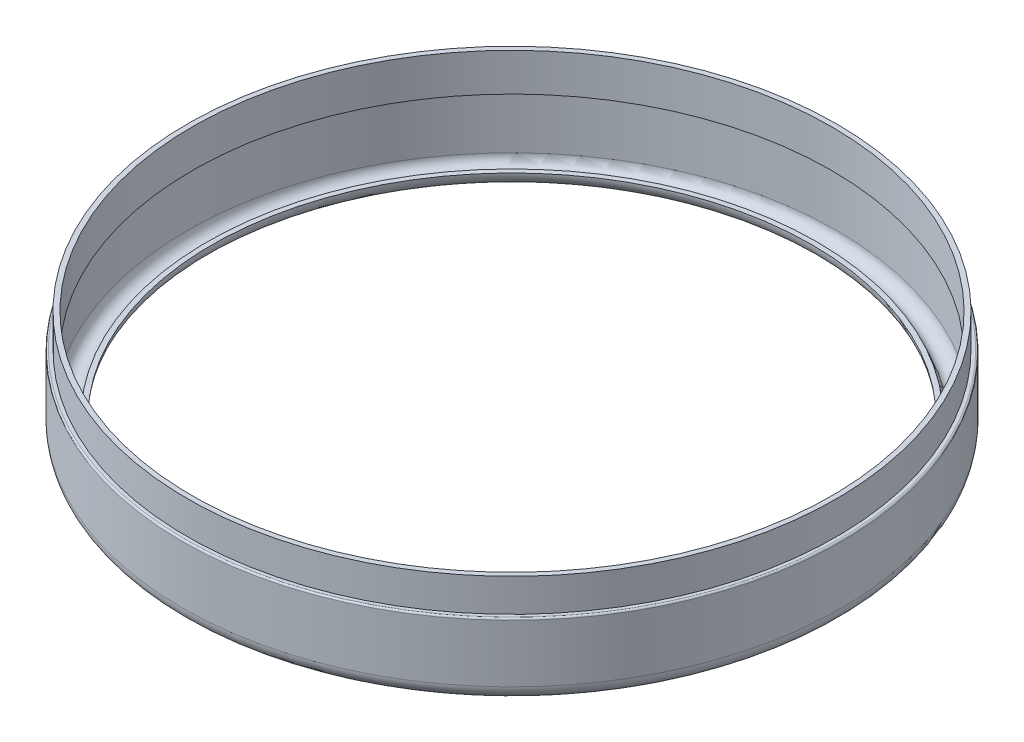
from build123d import *

# Parameters (mm, degrees)
FILLET1_R = 0.5


with BuildPart() as part:
    # Sketch1 → Revolve1 (revolve)
    with BuildSketch(Plane.YZ, mode=Mode.PRIVATE) as revolve1_sk:
        with BuildLine():
            Line((-9, 100), (9, 100))
            Line((9, 100), (9, 98.5))
            Line((9, 98.5), (19, 98.5))
            Line((19, 98.5), (19, 97))
            Line((19, 97), (7.5, 97))
            Line((7.5, 97), (7.5, 98.5))
            Line((7.5, 98.5), (-9, 98.5))
            ThreePointArc((-9, 98.5), (-12, 95.5), (-9, 92.5))
            Line((-9, 92.5), (-9, 91))
            ThreePointArc((-9, 91), (-13.5, 95.5), (-9, 100))
        make_face()
    revolve(revolve1_sk.sketch.rotate(Axis((0, -178.136934236, 0), (0, 1, 0)), 180), axis=Axis((0, -178.136934236, 0), (0, 1, 0)))

    # Fillet1
    fillet1_edges = [part.edges().sort_by_distance(p)[0] for p in [
        (0, 9, 100),
    ]]
    fillet(fillet1_edges, radius=FILLET1_R)


solid = part.part
